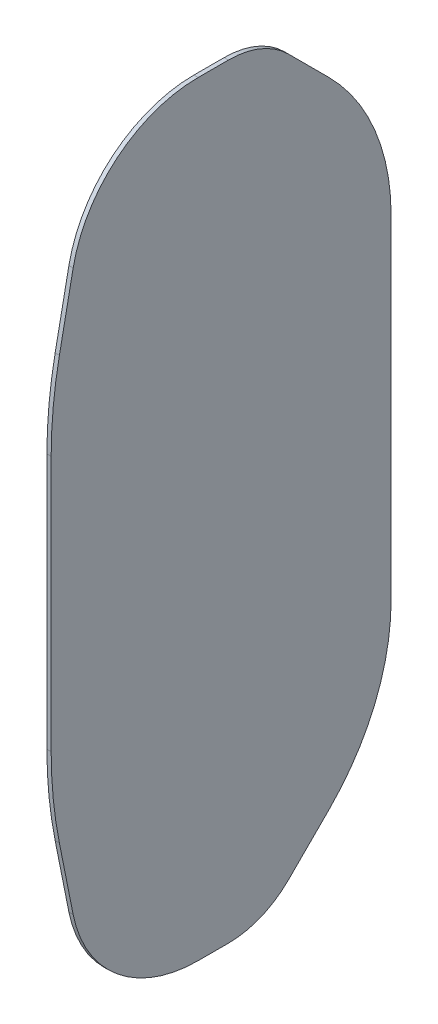
from build123d import *

# Parameters (mm, degrees)
BOSS_EXTRUDE1_DEPTH = 1
FILLET1_R           = 100
FILLET2_R           = 30
FILLET3_R           = 20
FILLET4_R           = 50


with BuildPart() as part:
    # Sketch1 → Boss-Extrude1 (new body)
    with BuildSketch(Plane.YZ):
        Polygon((-40, 40), (40, 40), (90, 30), (90, 0), (90, -10), (60, -40), (-60, -40), (-90, -10), (-90, 0), (-90, 30), align=None)
    extrude(amount=BOSS_EXTRUDE1_DEPTH)

    # Fillet1
    fillet1_edges = [part.edges().sort_by_distance(p)[0] for p in [
        (0.5, -40, 40),
        (0.5, 40, 40),
    ]]
    fillet(fillet1_edges, radius=FILLET1_R)

    # Fillet2
    fillet2_edges = [part.edges().sort_by_distance(p)[0] for p in [
        (0.5, 90, 30),
        (0.5, -90, 30),
    ]]
    fillet(fillet2_edges, radius=FILLET2_R)

    # Fillet3
    fillet3_edges = [part.edges().sort_by_distance(p)[0] for p in [
        (0.5, 90, -10),
        (0.5, -90, -10),
    ]]
    fillet(fillet3_edges, radius=FILLET3_R)

    # Fillet4
    fillet4_edges = [part.edges().sort_by_distance(p)[0] for p in [
        (0.5, 60, -40),
        (0.5, -60, -40),
    ]]
    fillet(fillet4_edges, radius=FILLET4_R)


solid = part.part
